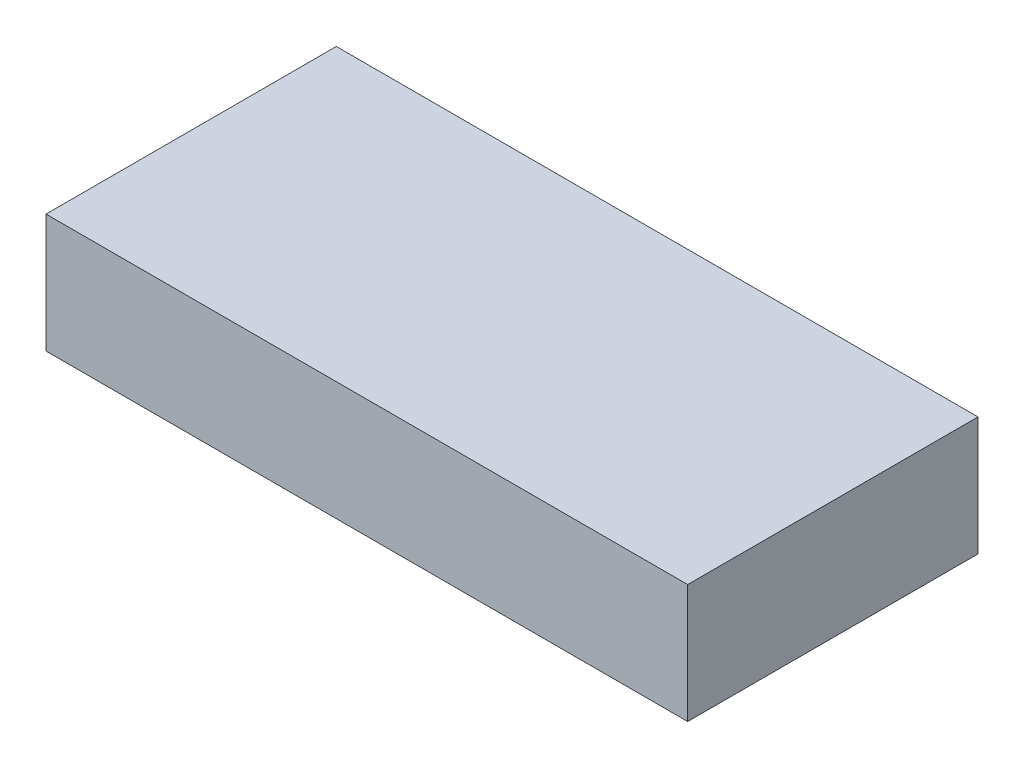
from build123d import *

# Parameters (mm, degrees)
SKETCH1_W           = 107.2
SKETCH1_H           = 48.5
BOSS_EXTRUDE1_DEPTH = 19.82


with BuildPart() as part:
    # Sketch1 → Boss-Extrude1 (new body)
    with BuildSketch(Plane(origin=(0, 0, 0), x_dir=(1, 0, 0), z_dir=(0, 1, 0))):
        with Locations((53.6, 24.25)):
            Rectangle(SKETCH1_W, SKETCH1_H)
    extrude(amount=BOSS_EXTRUDE1_DEPTH)


solid = part.part
